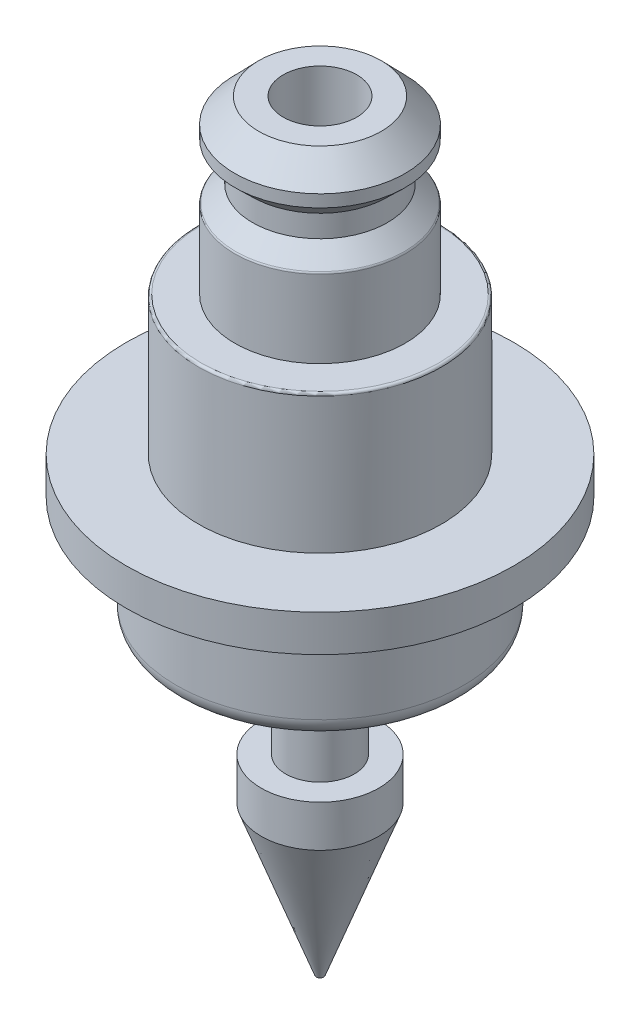
from build123d import *

# Parameters (mm, degrees)
GREEN_BASE_FILLET_R = 0.75
METAL_TOP_FILLETS_R = 0.1


with BuildPart() as part:
    # Body Sketch → Body Revolve (revolve)
    with BuildSketch(Plane.XY, mode=Mode.PRIVATE) as body_revolve_sk:
        Polygon((1.5, 14.15), (2.5, 14.15), (3.475, 13.15), (3.475, 12.65), (2.75, 11.95), (2.75, 11.05), (3.475, 10.35), (3.475, 7.15), (4.955, 7.15), (4.955, 1.5), (7.9, 1.5), (7.9, 0), (5.85, 0), (5.85, -4.5), (1.4, -4.5), (1.4, -9.1), (2.4, -9.1), (2.4, -10.8), (0.15, -16.9), (0.15, 0), (1.5, 0), align=None)
    revolve(body_revolve_sk.sketch.rotate(Axis((0, 0, 0), (0, 1, 0)), 90), axis=Axis((0, 0, 0), (0, 1, 0)))

    # Green Base Fillet
    green_base_fillet_edges = [part.edges().sort_by_distance(p)[0] for p in [
        (0, -4.5, 5.85),
    ]]
    fillet(green_base_fillet_edges, radius=GREEN_BASE_FILLET_R)

    # Metal Top Fillets
    metal_top_fillets_edges = [part.edges().sort_by_distance(p)[0] for p in [
        (0, 7.15, 4.955),
        (0, 10.35, 3.475),
    ]]
    fillet(metal_top_fillets_edges, radius=METAL_TOP_FILLETS_R)


solid = part.part
